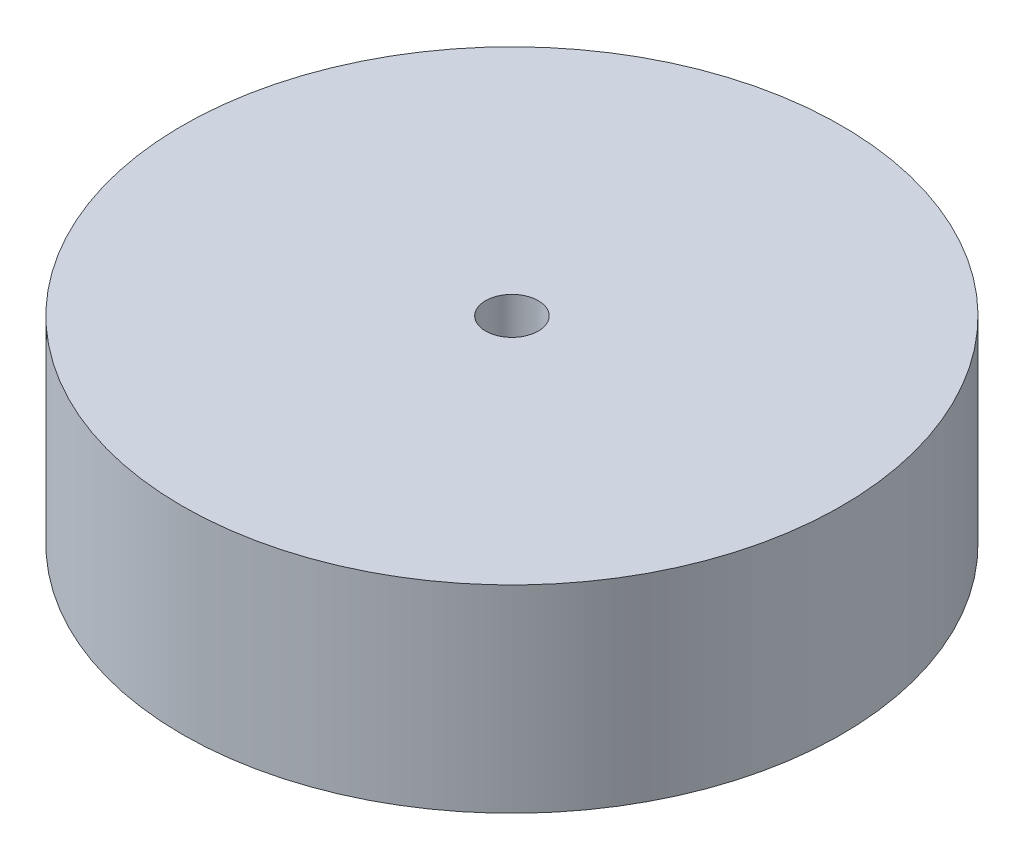
from build123d import *

# Parameters (mm, degrees)
SKETCH1_R           = 50
SKETCH1_R_2         = 4
BOSS_EXTRUDE1_DEPTH = 30


with BuildPart() as part:
    # Sketch1 → Boss-Extrude1 (new body)
    with BuildSketch(Plane(origin=(0, 0, 0), x_dir=(1, 0, 0), z_dir=(0, 1, 0))):
        with Locations(Location((0, 0, 0), (0, 0, 270))):
            Circle(SKETCH1_R)
        with Locations(Location((0, 0, 0), (0, 0, 270))):
            Circle(SKETCH1_R_2, mode=Mode.SUBTRACT)
    extrude(amount=BOSS_EXTRUDE1_DEPTH)


solid = part.part
